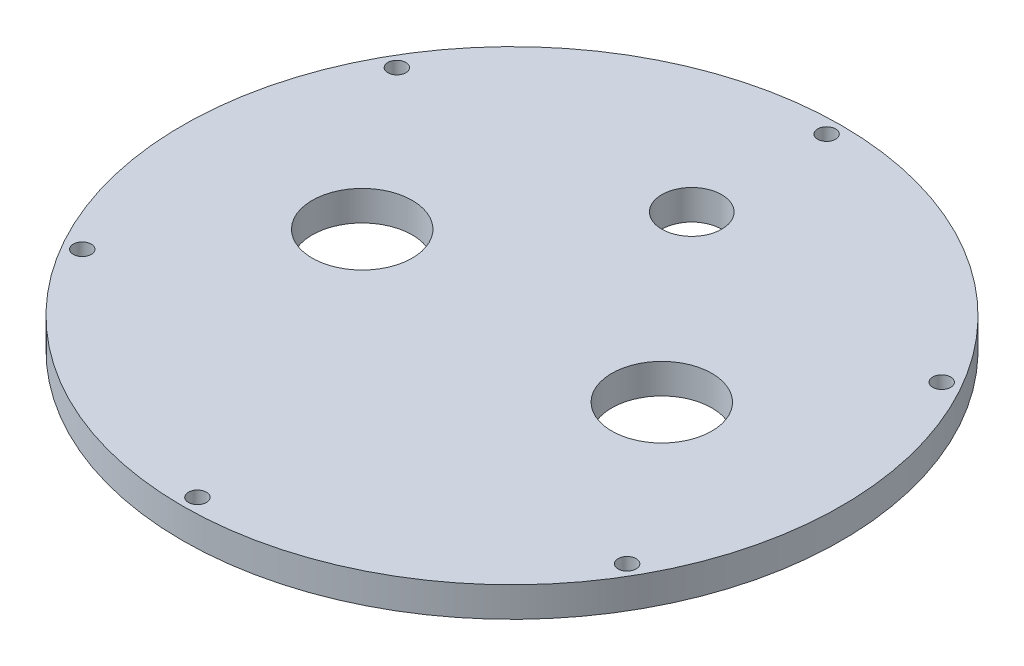
from build123d import *

# Parameters (mm, degrees)
SKETCH_1_R          = 55
SKETCH_1_R_2        = 1.5
EXTRUDE_1_DEPTH     = 5
SKETCH_4_R          = 5
CUT_EXTRUDE_1_DEPTH = 10
SKETCH_5_R          = 8.35
CUT_EXTRUDE_2_DEPTH = 78.942286341


with BuildPart() as part:
    # 草图1 → 凸台-拉伸1 (new body)
    with BuildSketch(Plane(origin=(0, 0, 0), x_dir=(1, 0, 0), z_dir=(0, 1, 0))):
        with Locations(Location((0, 0, 0), (0, 0, 270))):
            Circle(SKETCH_1_R)
        with Locations(Location((0, 52.5, 0), (0, 0, 270))):
            Circle(SKETCH_1_R_2, mode=Mode.SUBTRACT)
        with Locations(Location((45.466333699, 26.25, 0), (0, 0, 270))):
            Circle(SKETCH_1_R_2, mode=Mode.SUBTRACT)
        with Locations(Location((45.466333699, -26.25, 0), (0, 0, 270))):
            Circle(SKETCH_1_R_2, mode=Mode.SUBTRACT)
        with Locations(Location((0, -52.5, 0), (0, 0, 270))):
            Circle(SKETCH_1_R_2, mode=Mode.SUBTRACT)
        with Locations(Location((-45.466333699, -26.25, 0), (0, 0, 270))):
            Circle(SKETCH_1_R_2, mode=Mode.SUBTRACT)
        with Locations(Location((-45.466333699, 26.25, 0), (0, 0, 270))):
            Circle(SKETCH_1_R_2, mode=Mode.SUBTRACT)
    extrude(amount=EXTRUDE_1_DEPTH)

    # 草图4 → 切除-拉伸1 (cut)
    with BuildSketch(Plane(origin=(0, 5, 0), x_dir=(1, 0, 0), z_dir=(0, 1, 0))):
        with Locations(Location((0, 30, 0), (0, 0, 270))):
            Circle(SKETCH_4_R)
    extrude(amount=-CUT_EXTRUDE_1_DEPTH, mode=Mode.SUBTRACT)

    # 草图5 → 切除-拉伸2 (cut, through all)
    with BuildSketch(Plane.XZ):
        with Locations(Location((-25, 0, 0), (0, 0, 270))):
            Circle(SKETCH_5_R)
        with Locations(Location((25, 0, 0), (0, 0, 270))):
            Circle(SKETCH_5_R)
    extrude(amount=-CUT_EXTRUDE_2_DEPTH, mode=Mode.SUBTRACT)


solid = part.part
